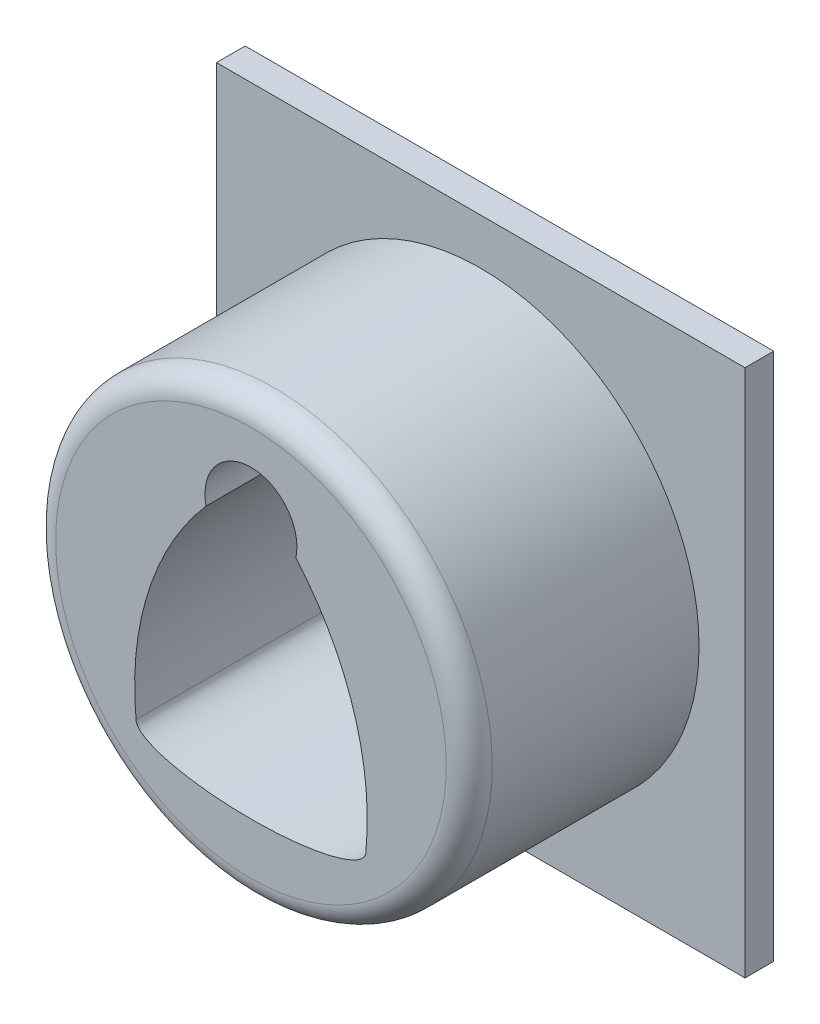
from build123d import *

# Parameters (mm, degrees)
SKETCH_1_R          = 3.8
EXTRUDE_1_DEPTH     = 4
SKETCH_2_W          = 9.2
SKETCH_2_H          = 9.2
EXTRUDE_2_DEPTH     = 0.5
FILLET_1_R          = 0.4
SKETCH_7_RX         = 2
SKETCH_7_RY         = 0.5
SKETCH_7_R          = 0.8
CUT_EXTRUDE_4_DEPTH = 4
SKETCH_8_R          = 0.6
CUT_EXTRUDE_5_DEPTH = 8.636753237


with BuildPart() as part:
    # Эскиз1 → Бобышка-Вытянуть1 (new body)
    with BuildSketch(Plane.XY):
        Circle(SKETCH_1_R)
    extrude(amount=EXTRUDE_1_DEPTH)

    # Эскиз2 → Бобышка-Вытянуть2 (add)
    with BuildSketch(Plane(origin=(0, 0, 0), x_dir=(-1, 0, 0), z_dir=(0, 0, -1))):
        Rectangle(SKETCH_2_W, SKETCH_2_H)
    extrude(amount=EXTRUDE_2_DEPTH)

    # Скругление1
    fillet_1_edges = [part.edges().sort_by_distance(p)[0] for p in [
        (-3.8, 0, 4),
    ]]
    fillet(fillet_1_edges, radius=FILLET_1_R)

    # Эскиз7 → Вырез-Вытянуть4 (cut)
    with BuildSketch(Plane.XY.offset(4)):
        with BuildLine():
            ThreePointArc((0.780530418, 1.824579743), (0, 1.2), (-0.780530418, 1.824579743))
            ThreePointArc((-0.780530418, 1.824579743), (-1.785343213, 0.036245206), (-2, -2.003782154))
            add(Edge.make_bspline(
                [(2, -2.003782154), (2, -1.503782154), (0, -1.503782154), (-2, -1.503782154), (-2, -2.003782154)],
                knots=[0, 0, 0, 1.570796327, 1.570796327, 3.141592654, 3.141592654, 3.141592654], degree=2, weights=[1, 0.707106781, 1, 0.707106781, 1]))
            ThreePointArc((2, -2.003782154), (1.785343213, 0.036245206), (0.780530418, 1.824579743))
        make_face()
        with Locations((0, -2.003782154)):
            Ellipse(SKETCH_7_RX, SKETCH_7_RY)
        with Locations((0, 2)):
            Circle(SKETCH_7_R)
    extrude(amount=-CUT_EXTRUDE_4_DEPTH, mode=Mode.SUBTRACT)

    # Эскиз8 → Вырез-Вытянуть5 (cut, through all)
    with BuildSketch(Plane.XY):
        Circle(SKETCH_8_R)
    extrude(amount=-CUT_EXTRUDE_5_DEPTH, mode=Mode.SUBTRACT)


solid = part.part
